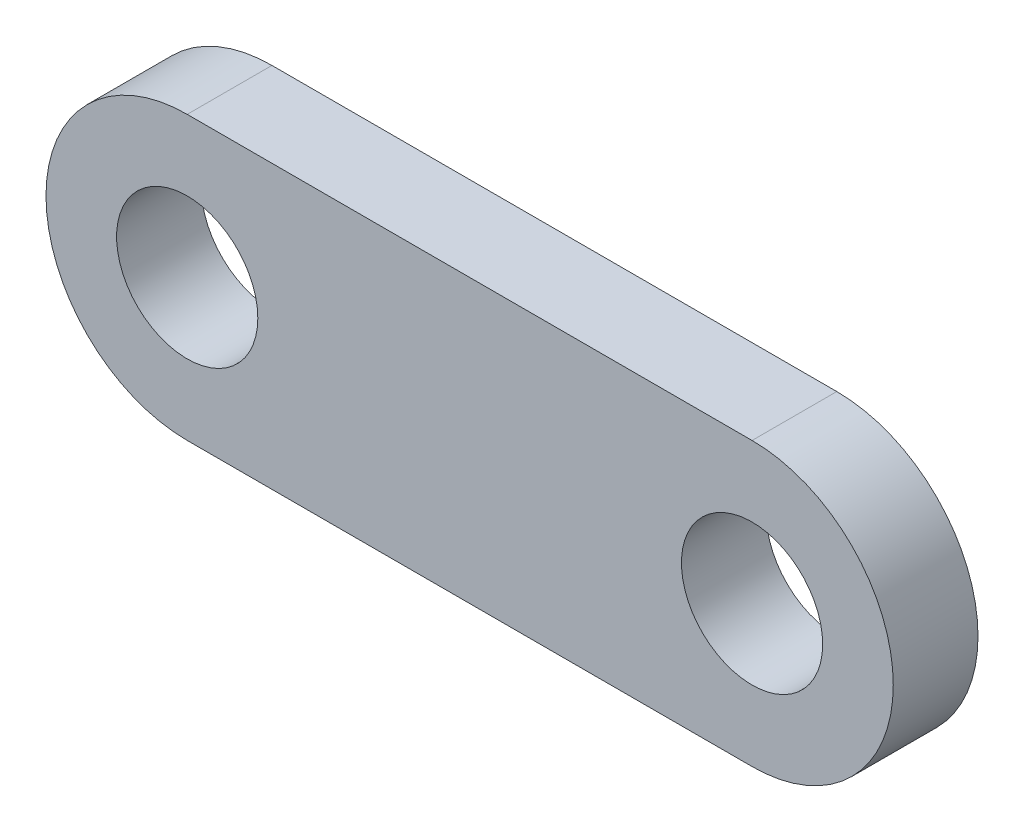
from build123d import *

# Parameters (mm, degrees)
SKETCH1_R           = 2.5
BOSS_EXTRUDE1_DEPTH = 3


with BuildPart() as part:
    # Sketch1 → Boss-Extrude1 (new body)
    with BuildSketch(Plane.XY):
        with BuildLine():
            Line((0, -5), (-20, -5))
            ThreePointArc((-20, -5), (-25, 0), (-20, 5))
            Line((-20, 5), (0, 5))
            ThreePointArc((0, 5), (5, 0), (0, -5))
        make_face()
        with Locations((-20, 0)):
            Circle(SKETCH1_R, mode=Mode.SUBTRACT)
        Circle(SKETCH1_R, mode=Mode.SUBTRACT)
    extrude(amount=BOSS_EXTRUDE1_DEPTH)


solid = part.part
